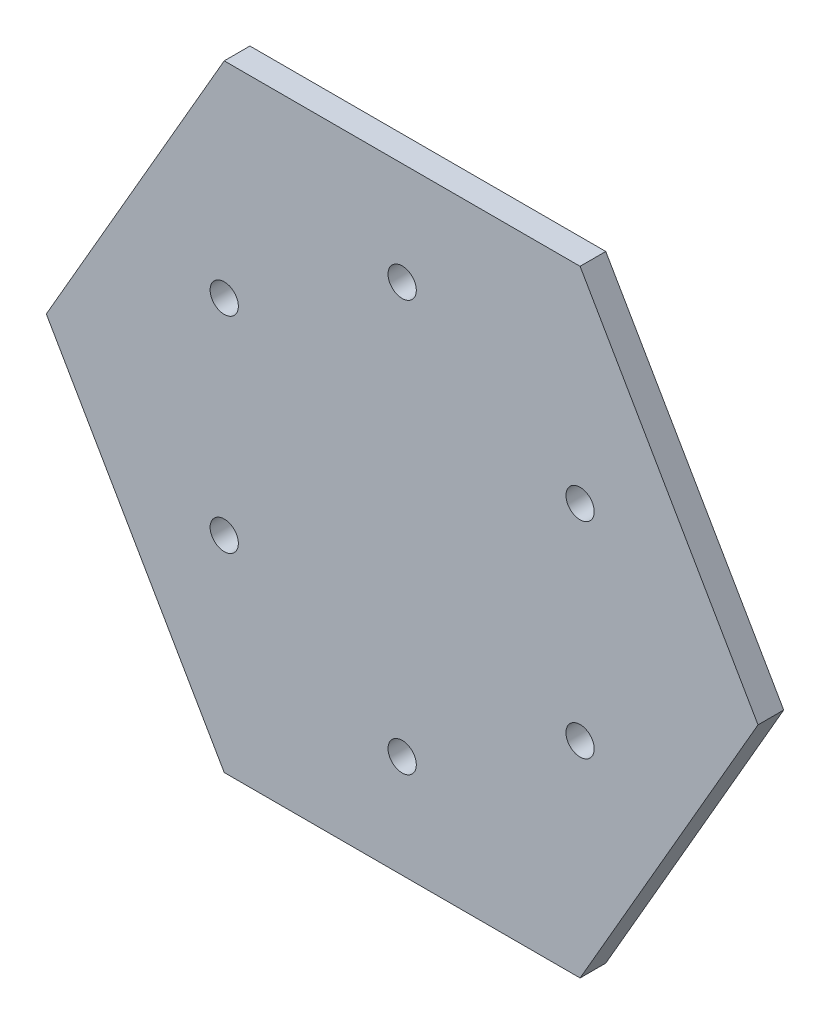
from build123d import *

# Parameters (mm, degrees)
SKETCH1_R           = 10.4775
BOSS_EXTRUDE1_DEPTH = 19.05


with BuildPart() as part:
    # Sketch1 → Boss-Extrude1 (new body)
    # profile 1 of 6: a face of its own
    with BuildSketch(Plane.XY):
        Polygon((-263.964543073, 0), (-131.982271537, 228.6), (0, 0), align=None)
        with Locations(Location((-131.982271537, 76.2, 0), (0, 0, 180))):
            Circle(SKETCH1_R, mode=Mode.SUBTRACT)
    # profile 2 of 6: a face of its own
    with BuildSketch(Plane.XY):
        Polygon((131.982271537, 228.6), (0, 0), (-131.982271537, 228.6), align=None)
        with Locations(Location((0, 152.4, 0), (0, 0, 180))):
            Circle(SKETCH1_R, mode=Mode.SUBTRACT)
    # profile 3 of 6: a face of its own
    with BuildSketch(Plane.XY):
        Polygon((263.964543073, 0), (0, 0), (131.982271537, 228.6), align=None)
        with Locations(Location((131.982271537, 76.2, 0), (0, 0, 180))):
            Circle(SKETCH1_R, mode=Mode.SUBTRACT)
    # profile 4 of 6: a face of its own
    with BuildSketch(Plane.XY):
        Polygon((131.982271537, -228.6), (0, 0), (263.964543073, 0), align=None)
        with Locations(Location((131.982271537, -76.2, 0), (0, 0, 180))):
            Circle(SKETCH1_R, mode=Mode.SUBTRACT)
    # profile 5 of 6: a face of its own
    with BuildSketch(Plane.XY):
        Polygon((-131.982271537, -228.6), (0, 0), (131.982271537, -228.6), align=None)
        with Locations(Location((0, -152.4, 0), (0, 0, 180))):
            Circle(SKETCH1_R, mode=Mode.SUBTRACT)
    # profile 6 of 6: a face of its own
    with BuildSketch(Plane.XY):
        Polygon((-263.964543073, 0), (0, 0), (-131.982271537, -228.6), align=None)
        with Locations(Location((-131.982271537, -76.2, 0), (0, 0, 180))):
            Circle(SKETCH1_R, mode=Mode.SUBTRACT)
    extrude(amount=BOSS_EXTRUDE1_DEPTH)


solid = part.part
